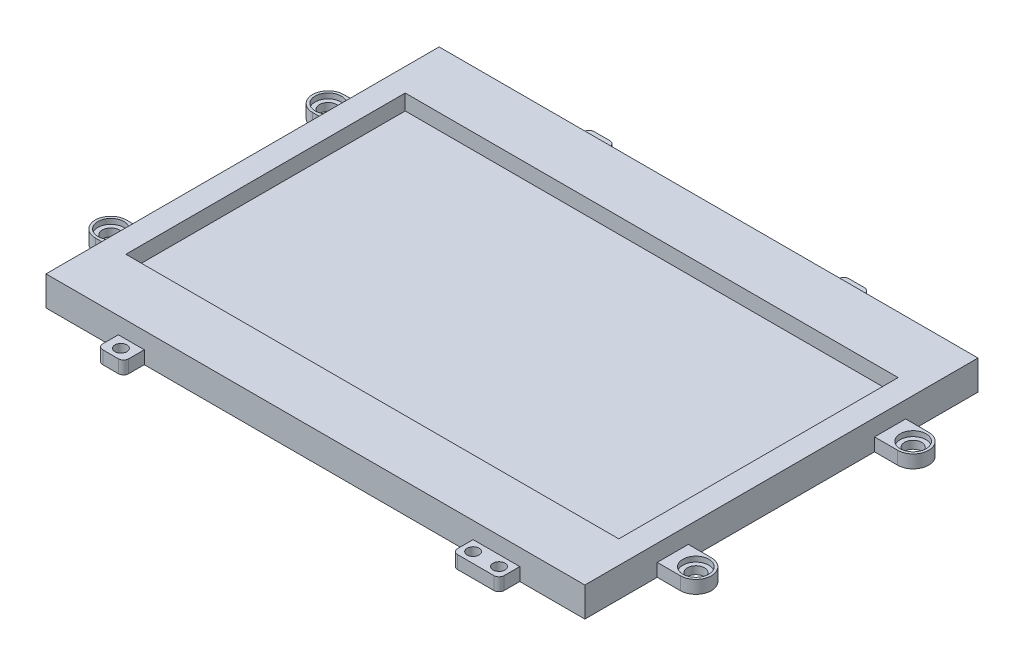
from build123d import *

# Parameters (mm, degrees)
SKETCH_1_W          = 103.9
SKETCH_1_H          = 75.8
EXTRUDE_1_DEPTH     = 5.7
SKETCH_2_R          = 3
SKETCH_2_R_2        = 1.65
SKETCH_2_W          = 5
SKETCH_2_H          = 4
SKETCH_2_R_3        = 1.15
SKETCH_2_W_2        = 9
EXTRUDE_2_DEPTH     = 2.5
FILLET_1_R          = 1
SKETCH_3_R          = 2.5
CUT_EXTRUDE_1_DEPTH = 1
SKETCH_4_W          = 95.04
SKETCH_4_H          = 53.86
CUT_EXTRUDE_2_DEPTH = 3


with BuildPart() as part:
    # 草图1 → 凸台-拉伸1 (new body)
    with BuildSketch(Plane(origin=(0, 0, 0), x_dir=(1, 0, 0), z_dir=(0, 1, 0))):
        Rectangle(SKETCH_1_W, SKETCH_1_H)
    extrude(amount=EXTRUDE_1_DEPTH)

    # 草图2 → 凸台-拉伸2 (add)
    # profile 1 of 12: a face of its own
    with BuildSketch(Plane(origin=(0, 0, 0), x_dir=(1, 0, 0), z_dir=(0, 1, 0))):
        with BuildLine():
            ThreePointArc((-53.4, 20.95), (-54.278679656, 18.828679656), (-56.4, 17.95))
            Line((-56.4, 17.95), (-51.95, 17.95))
            Line((-51.95, 17.95), (-51.95, 23.95))
            Line((-51.95, 23.95), (-56.4, 23.95))
            ThreePointArc((-56.4, 23.95), (-54.278679656, 23.071320344), (-53.4, 20.95))
        make_face()
    # profile 2 of 12: a face of its own
    with BuildSketch(Plane(origin=(0, 0, 0), x_dir=(1, 0, 0), z_dir=(0, 1, 0))):
        with Locations((-56.4, 20.95)):
            Circle(SKETCH_2_R)
        with Locations(Location((-56.4, 20.95, 0), (0, 0, 270))):
            Circle(SKETCH_2_R_2, mode=Mode.SUBTRACT)
    # profile 3 of 12: a face of its own
    with BuildSketch(Plane(origin=(0, 0, 0), x_dir=(1, 0, 0), z_dir=(0, 1, 0))):
        with Locations((-24.55, 39.9)):
            Rectangle(SKETCH_2_W, SKETCH_2_H)
        with Locations(Location((-24.55, 39.9, 0), (0, 0, 270))):
            Circle(SKETCH_2_R_3, mode=Mode.SUBTRACT)
    # profile 4 of 12: a face of its own
    with BuildSketch(Plane(origin=(0, 0, 0), x_dir=(1, 0, 0), z_dir=(0, 1, 0))):
        with Locations((24.55, 39.9)):
            Rectangle(SKETCH_2_W, SKETCH_2_H)
        with Locations(Location((24.55, 39.9, 0), (0, 0, 270))):
            Circle(SKETCH_2_R_3, mode=Mode.SUBTRACT)
    # profile 5 of 12: a face of its own
    with BuildSketch(Plane(origin=(0, 0, 0), x_dir=(1, 0, 0), z_dir=(0, 1, 0))):
        with BuildLine():
            Line((51.95, 17.95), (56.4, 17.95))
            ThreePointArc((56.4, 17.95), (53.4, 20.95), (56.4, 23.95))
            Line((56.4, 23.95), (51.95, 23.95))
            Line((51.95, 23.95), (51.95, 17.95))
        make_face()
    # profile 6 of 12: a face of its own
    with BuildSketch(Plane(origin=(0, 0, 0), x_dir=(1, 0, 0), z_dir=(0, 1, 0))):
        with Locations((56.4, 20.95)):
            Circle(SKETCH_2_R)
        with Locations(Location((56.4, 20.95, 0), (0, 0, 270))):
            Circle(SKETCH_2_R_2, mode=Mode.SUBTRACT)
    # profile 7 of 12: a face of its own
    with BuildSketch(Plane(origin=(0, 0, 0), x_dir=(1, 0, 0), z_dir=(0, 1, 0))):
        with Locations((56.4, -20.95)):
            Circle(SKETCH_2_R)
        with Locations(Location((56.4, -20.95, 0), (0, 0, 270))):
            Circle(SKETCH_2_R_2, mode=Mode.SUBTRACT)
    # profile 8 of 12: a face of its own
    with BuildSketch(Plane(origin=(0, 0, 0), x_dir=(1, 0, 0), z_dir=(0, 1, 0))):
        with BuildLine():
            ThreePointArc((56.4, -23.95), (53.4, -20.95), (56.4, -17.95))
            Line((56.4, -17.95), (51.95, -17.95))
            Line((51.95, -17.95), (51.95, -23.95))
            Line((51.95, -23.95), (56.4, -23.95))
        make_face()
    # profile 9 of 12: a face of its own
    with BuildSketch(Plane(origin=(0, 0, 0), x_dir=(1, 0, 0), z_dir=(0, 1, 0))):
        with Locations((34.9, -39.9)):
            Rectangle(SKETCH_2_W_2, SKETCH_2_H)
        with Locations(Location((37.4, -39.9, 0), (0, 0, 270))):
            Circle(SKETCH_2_R_3, mode=Mode.SUBTRACT)
        with Locations(Location((32.4, -39.9, 0), (0, 0, 270))):
            Circle(SKETCH_2_R_3, mode=Mode.SUBTRACT)
    # profile 10 of 12: a face of its own
    with BuildSketch(Plane(origin=(0, 0, 0), x_dir=(1, 0, 0), z_dir=(0, 1, 0))):
        with Locations((-35.5, -39.9)):
            Rectangle(SKETCH_2_W, SKETCH_2_H)
        with Locations(Location((-35.5, -39.9, 0), (0, 0, 270))):
            Circle(SKETCH_2_R_3, mode=Mode.SUBTRACT)
    # profile 11 of 12: a face of its own
    with BuildSketch(Plane(origin=(0, 0, 0), x_dir=(1, 0, 0), z_dir=(0, 1, 0))):
        with Locations((-56.4, -20.95)):
            Circle(SKETCH_2_R)
        with Locations(Location((-56.4, -20.95, 0), (0, 0, 270))):
            Circle(SKETCH_2_R_2, mode=Mode.SUBTRACT)
    # profile 12 of 12: a face of its own
    with BuildSketch(Plane(origin=(0, 0, 0), x_dir=(1, 0, 0), z_dir=(0, 1, 0))):
        with BuildLine():
            ThreePointArc((-53.4, -20.95), (-54.278679656, -23.071320344), (-56.4, -23.95))
            Line((-56.4, -23.95), (-51.95, -23.95))
            Line((-51.95, -23.95), (-51.95, -17.95))
            Line((-51.95, -17.95), (-56.4, -17.95))
            ThreePointArc((-56.4, -17.95), (-54.278679656, -18.828679656), (-53.4, -20.95))
        make_face()
    extrude(amount=EXTRUDE_2_DEPTH)

    # 圆角1
    fillet_1_edges = [part.edges().sort_by_distance(p)[0] for p in [
        (-27.05, 1.25, -41.9),
        (-22.05, 1.25, -41.9),
        (22.05, 1.25, -41.9),
        (27.05, 1.25, -41.9),
        (30.4, 1.25, 41.9),
        (39.4, 1.25, 41.9),
        (-38, 1.25, 41.9),
        (-33, 1.25, 41.9),
    ]]
    fillet(fillet_1_edges, radius=FILLET_1_R)

    # 草图3 → 切除-拉伸1 (cut)
    with BuildSketch(Plane(origin=(0, 2.5, 0), x_dir=(1, 0, 0), z_dir=(0, 1, 0))):
        with Locations(Location((-56.4, -20.95, 0), (0, 0, 270))):
            Circle(SKETCH_3_R)
        with Locations(Location((-56.4, 20.95, 0), (0, 0, 270))):
            Circle(SKETCH_3_R)
        with Locations(Location((56.4, 20.95, 0), (0, 0, 270))):
            Circle(SKETCH_3_R)
        with Locations(Location((56.4, -20.95, 0), (0, 0, 270))):
            Circle(SKETCH_3_R)
    extrude(amount=-CUT_EXTRUDE_1_DEPTH, mode=Mode.SUBTRACT)

    # 草图4 → 切除-拉伸2 (cut)
    with BuildSketch(Plane(origin=(0, 5.7, 0), x_dir=(1, 0, 0), z_dir=(0, 1, 0))):
        Rectangle(SKETCH_4_W, SKETCH_4_H)
    extrude(amount=-CUT_EXTRUDE_2_DEPTH, mode=Mode.SUBTRACT)


solid = part.part
